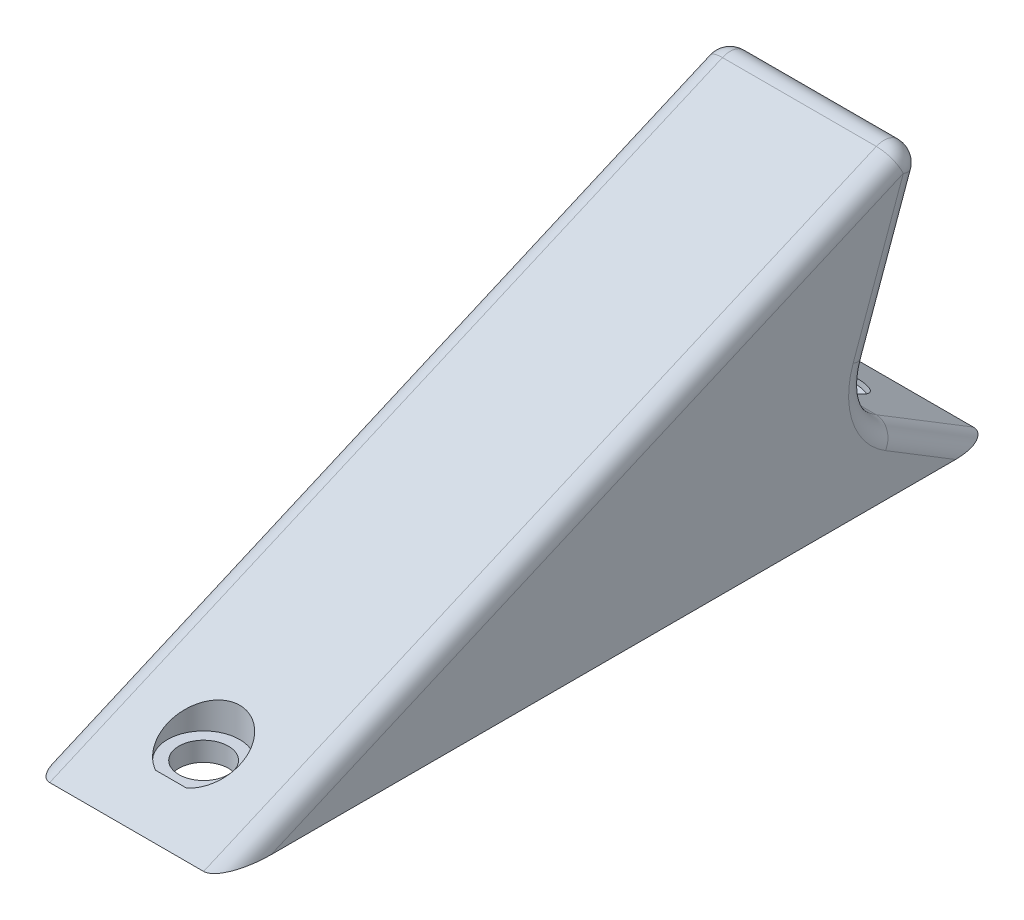
from build123d import *

# Parameters (mm, degrees)
BOSS_EXTRUDE1_DEPTH = 25.4
FILLET4_R           = 7.62
FILLET5_R           = 2.54
FILLET6_R           = 2.54
SKETCH2_R           = 3.2639
CUT_EXTRUDE1_DEPTH  = 10.16
SKETCH3_R           = 4.7625
CUT_EXTRUDE4_DEPTH  = 10.16


with BuildPart() as part:
    # Sketch1 → Boss-Extrude1 (new body)
    with BuildSketch(Plane(origin=(0, 0, 0), x_dir=(0, 0, -1), z_dir=(1, 0, 0))):
        Polygon((-50.8, 0), (50.8, 0), (32.681037195, 11.050662882), (43.390895004, 40.811843798), align=None)
    extrude(amount=BOSS_EXTRUDE1_DEPTH)

    # Fillet4
    fillet4_edges = [part.edges().sort_by_distance(p)[0] for p in [
        (12.7, 11.050662882, -32.681037195),
    ]]
    fillet(fillet4_edges, radius=FILLET4_R)

    # Fillet5
    fillet5_edges = [part.edges().sort_by_distance(p)[0] for p in [
        (12.7, 40.811843798, -43.390895004),
    ]]
    fillet(fillet5_edges, radius=FILLET5_R)

    # Fillet6
    fillet6_edges = [part.edges().sort_by_distance(p)[0] for p in [
        (25.4, 3.906974274, -44.39402035),
        (0, 26.09308805, -38.094203934),
        (25.4, 26.09308805, -38.094203934),
        (0, 11.786560732, -34.769020969),
        (25.4, 11.786560732, -34.769020969),
        (0, 19.238614503, 6.398616724),
        (25.4, 19.238614503, 6.398616724),
        (0, 37.998707408, -40.750789597),
        (25.4, 37.998707408, -40.750789597),
        (0, 3.906974274, -44.39402035),
    ]]
    fillet(fillet6_edges, radius=FILLET6_R)

    # Sketch2 → Cut-Extrude1 (cut)
    with BuildSketch(Plane.XZ):
        with Locations(Location((12.7, 40.64, 0), (0, 0, 270))):
            Circle(SKETCH2_R)
        with Locations(Location((12.7, -40.64, 0), (0, 0, 270))):
            Circle(SKETCH2_R)
    extrude(amount=-CUT_EXTRUDE1_DEPTH, mode=Mode.SUBTRACT)

    # Sketch3 → Cut-Extrude4 (cut)
    with BuildSketch(Plane(origin=(0, 2.54, 0), x_dir=(-1, 0, 0), z_dir=(0, -1, 0))):
        with Locations((-12.7, -40.64)):
            Circle(SKETCH3_R)
        with Locations(Location((-12.7, 40.64, 0), (0, 0, 90))):
            Circle(SKETCH3_R)
    extrude(amount=-CUT_EXTRUDE4_DEPTH, mode=Mode.SUBTRACT)


solid = part.part
